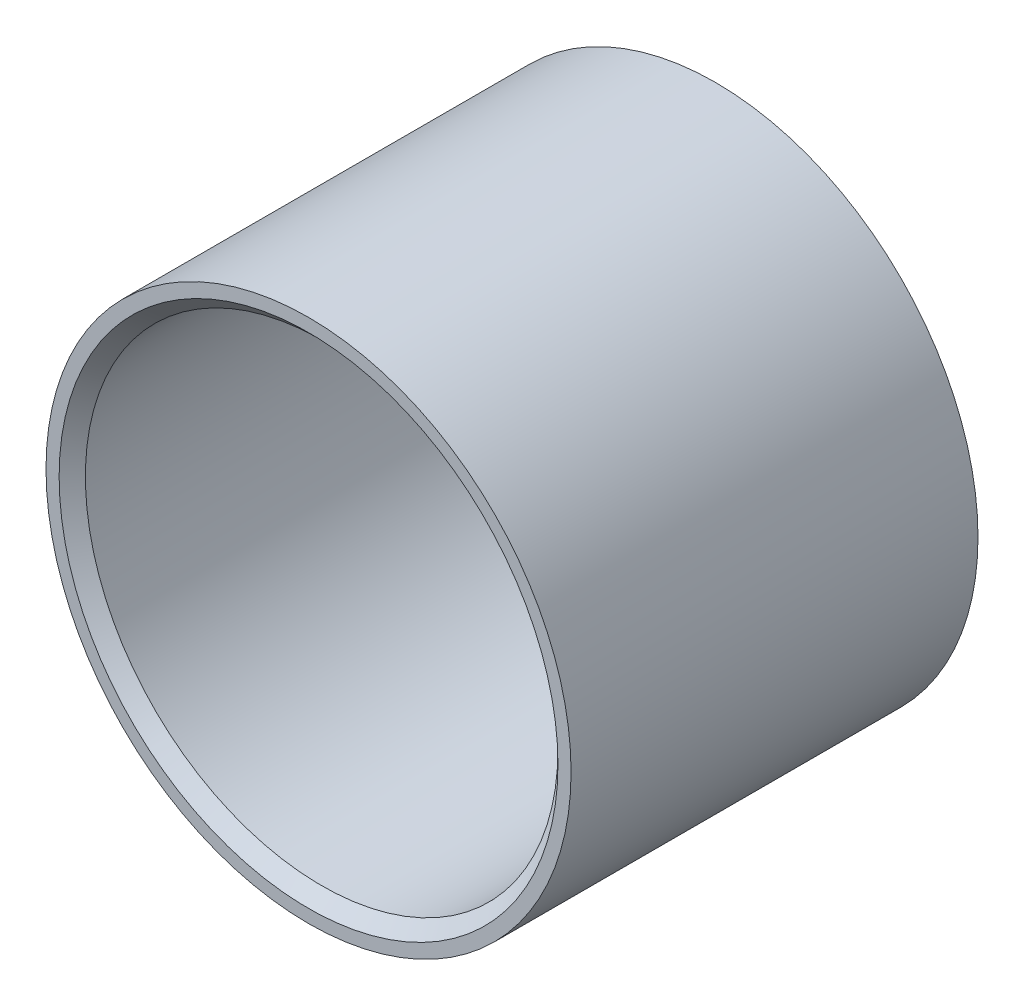
from build123d import *

# Parameters (mm, degrees)
SKETCH1_R           = 10
SKETCH1_R_2         = 9
BOSS_EXTRUDE1_DEPTH = 15.5
CHAMFER2_SIZE       = 0.5


with BuildPart() as part:
    # Sketch1 → Boss-Extrude1 (new body)
    with BuildSketch(Plane.XY):
        Circle(SKETCH1_R)
        Circle(SKETCH1_R_2, mode=Mode.SUBTRACT)
    extrude(amount=BOSS_EXTRUDE1_DEPTH)

    # Chamfer2
    chamfer2_edges = [part.edges().sort_by_distance(p)[0] for p in [
        (-9, 0, 0),
        (-9, 0, 15.5),
    ]]
    chamfer(chamfer2_edges, length=CHAMFER2_SIZE)


solid = part.part
